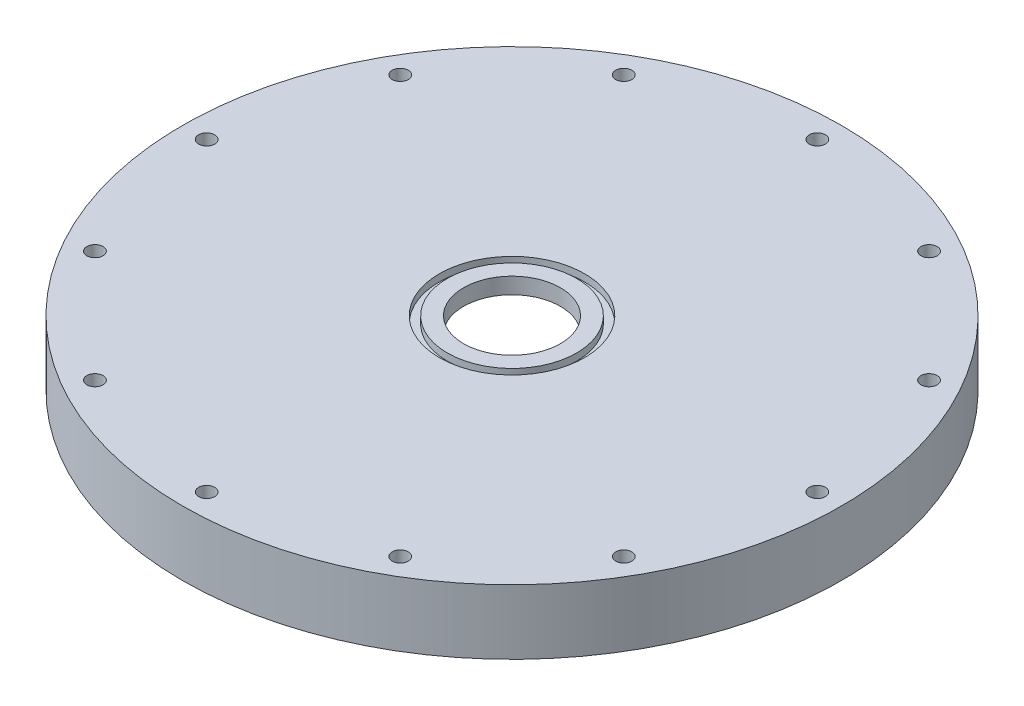
from build123d import *

# Parameters (mm, degrees)
SKETCH2_R                   = 19.05
CUT_EXTRUDE1_DEPTH          = 185.94967748
SKETCH3_R                   = 28.575
SKETCH3_R_2                 = 25.4
CUT_EXTRUDE2_DEPTH          = 2.794
F_1_4_0_25_DIAMETER_HOLE1_D = 6.35


with BuildPart() as part:
    # Sketch1 → Revolve1 (revolve)
    with BuildSketch(Plane.XY, mode=Mode.PRIVATE) as revolve1_sk:
        with BuildLine():
            Line((0, 0), (0, 6.35))
            Line((0, 6.35), (-129.54, 6.35))
            Line((-129.54, 6.35), (-129.54, -19.05))
            Line((-129.54, -19.05), (-86.36, -19.05))
            Line((-86.36, -19.05), (-86.36, -16.51))
            ThreePointArc((-86.36, -16.51), (-81.524332957, -4.835667043), (-69.85, 0))
            Line((-69.85, 0), (0, 0))
        make_face()
    revolve(revolve1_sk.sketch.rotate(Axis((0, 0, 0), (0, 1, 0)), 270), axis=Axis((0, 0, 0), (0, 1, 0)))

    # Sketch2 → Cut-Extrude1 (cut, through all)
    with BuildSketch(Plane(origin=(0, 6.35, 0), x_dir=(1, 0, 0), z_dir=(0, 1, 0))):
        with Locations(Location((0, 0, 0), (0, 0, 270))):
            Circle(SKETCH2_R)
    extrude(amount=-CUT_EXTRUDE1_DEPTH, mode=Mode.SUBTRACT)

    # Sketch3 → Cut-Extrude2 (cut)
    with BuildSketch(Plane(origin=(0, 6.35, 0), x_dir=(1, 0, 0), z_dir=(0, 1, 0))):
        with Locations(Location((0, 0, 0), (0, 0, 270))):
            Circle(SKETCH3_R)
        with Locations(Location((0, 0, 0), (0, 0, 270))):
            Circle(SKETCH3_R_2, mode=Mode.SUBTRACT)
    extrude(amount=-CUT_EXTRUDE2_DEPTH, mode=Mode.SUBTRACT)

    # 1/4 (0.25) Diameter Hole1 (through all)
    with Locations(Plane(origin=(0, 6.35, -120.015), x_dir=(0, 0, 1), z_dir=(0, 1, 0))):
        with Locations((0, 0), (16.078961165, -60.0075), (60.0075, -103.936038835), (120.015, -120.015), (180.0225, -103.936038835), (223.951038835, -60.0075), (240.03, 0), (223.951038835, 60.0075), (180.0225, 103.936038835), (120.015, 120.015), (60.0075, 103.936038835), (16.078961165, 60.0075)):
            Hole(F_1_4_0_25_DIAMETER_HOLE1_D / 2)


solid = part.part
